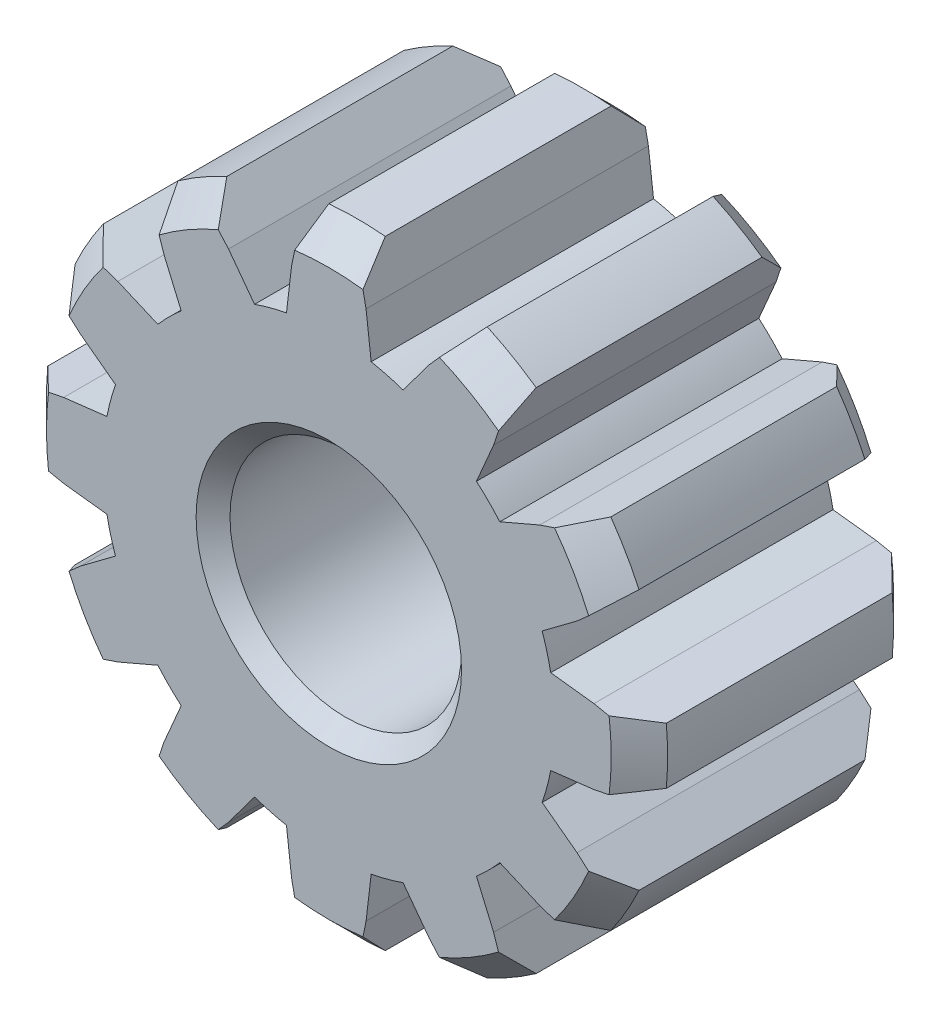
from build123d import *

# Parameters (mm, degrees)
SKETCH_1_R               = 2.05
EXTRUDE_1_DEPTH          = 2.5
PATTERN_CIRCULAR_1_COUNT = 12
CHAMFER_1_SIZE           = 0.5
CHAMFER_2_SIZE           = 0.5
CHAMFER_3_SIZE           = 0.3


with BuildPart() as part:
    # 스케치1 → 보스-돌출1 (new, symmetric)
    with BuildSketch(Plane.XY):
        with BuildLine():
            ThreePointArc((-0.75, 3.929058411), (0, -4), (0.75, 3.929058411))
            Line((0.75, 3.929058411), (0.659376088, 4.695031864))
            Line((0.659376088, 4.695031864), (0.5, 5.477225575))
            ThreePointArc((0.5, 5.477225575), (0, 5.5), (-0.5, 5.477225575))
            Line((-0.5, 5.477225575), (-0.659376088, 4.695031864))
            Line((-0.659376088, 4.695031864), (-0.75, 3.929058411))
        make_face()
        Circle(SKETCH_1_R, mode=Mode.SUBTRACT)
    extrude_1 = extrude(amount=EXTRUDE_1_DEPTH, both=True)

    # 원형 패턴1: 보스-돌출1 ×12 about axis
    pattern_circular_1_axis = Axis((0, 0, 0), (0, 0, 1))
    for i in range(1, PATTERN_CIRCULAR_1_COUNT):
        add(extrude_1.rotate(pattern_circular_1_axis, i * 360 / PATTERN_CIRCULAR_1_COUNT))

    # 모따기1
    chamfer_1_edges = [part.edges().sort_by_distance(p)[0] for p in [
        (0, 5.5, -2.5),
        (2.75, 4.763139721, -2.5),
        (5.5, 0, -2.5),
        (2.75, -4.763139721, -2.5),
        (-2.75, -4.763139721, -2.5),
        (-5.5, 0, -2.5),
        (-2.75, 4.763139721, -2.5),
        (-4.763139721, 2.75, -2.5),
        (-4.763139721, -2.75, -2.5),
        (0, -5.5, -2.5),
        (4.763139721, -2.75, -2.5),
        (4.763139721, 2.75, -2.5),
    ]]
    chamfer(chamfer_1_edges, length=CHAMFER_1_SIZE)

    # 모따기2
    chamfer_2_edges = [part.edges().sort_by_distance(p)[0] for p in [
        (4.763139721, 2.75, 2.5),
        (2.75, 4.763139721, 2.5),
        (0, 5.5, 2.5),
        (-2.75, 4.763139721, 2.5),
        (-4.763139721, 2.75, 2.5),
        (-5.5, 0, 2.5),
        (-4.763139721, -2.75, 2.5),
        (-2.75, -4.763139721, 2.5),
        (0, -5.5, 2.5),
        (2.75, -4.763139721, 2.5),
        (4.763139721, -2.75, 2.5),
        (5.5, 0, 2.5),
    ]]
    chamfer(chamfer_2_edges, length=CHAMFER_2_SIZE)

    # 모따기3
    chamfer_3_edges = [part.edges().sort_by_distance(p)[0] for p in [
        (-2.05, 0, 2.5),
        (-2.05, 0, -2.5),
    ]]
    chamfer(chamfer_3_edges, length=CHAMFER_3_SIZE)


solid = part.part
